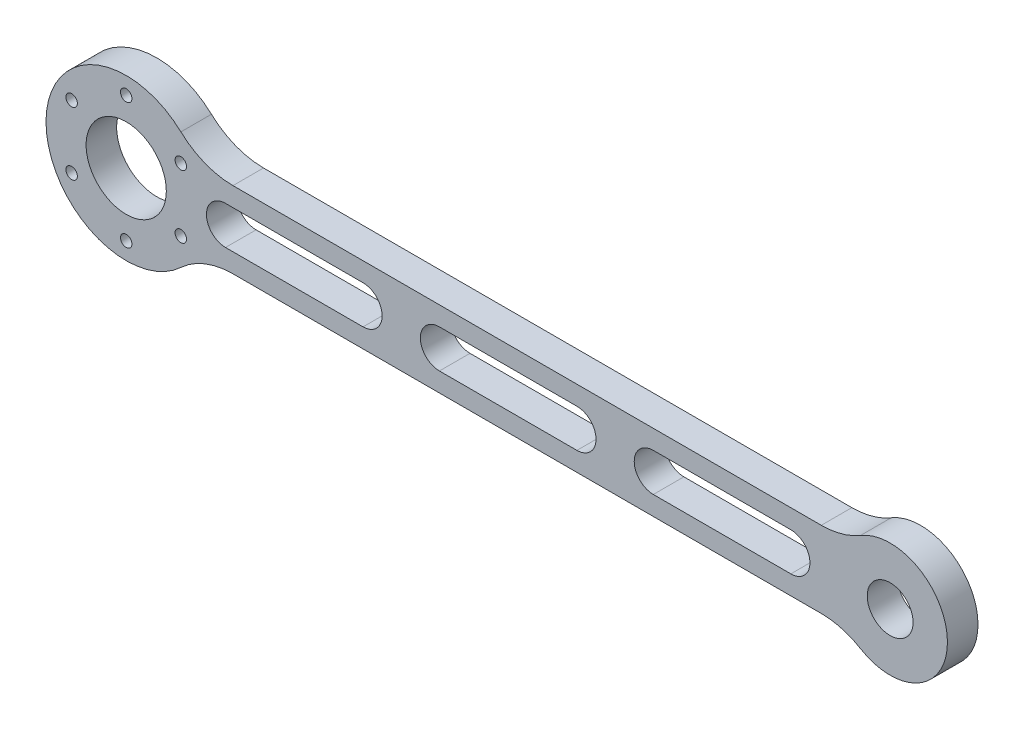
from build123d import *

# Parameters (mm, degrees)
EXTRUDE_1_DEPTH     = 8
FILLET_1_R          = 20
SKETCH_5_R          = 10.5
SKETCH_5_R_2        = 6
CUT_EXTRUDE_4_DEPTH = 10
CUT_EXTRUDE_5_DEPTH = 10
EXTRUDE_START       = -8
SKETCH_9_R          = 10.5
EXTRUDE_3_DEPTH     = 8
FILLET_2_R          = 20
SKETCH_10_R         = 1.5
CUT_EXTRUDE_7_DEPTH = 8


with BuildPart() as part:
    # 草图1 → 凸台-拉伸1 (new body)
    with BuildSketch(Plane.XY):
        with BuildLine():
            Line((0, -10), (0, 10))
            Line((0, 10), (11.180339887, 10))
            ThreePointArc((11.180339887, 10), (-15, 0), (11.180339887, -10))
            Line((11.180339887, -10), (0, -10))
        make_face()
        with BuildLine():
            Line((11.180339887, 10), (0, 10))
            Line((0, 10), (0, -10))
            Line((0, -10), (11.180339887, -10))
            ThreePointArc((11.180339887, -10), (14.012585384, -5.352331347), (15, 0))
            ThreePointArc((15, 0), (14.012585384, 5.352331347), (11.180339887, 10))
        make_face()
        with BuildLine():
            Line((188.819660113, 10), (11.180339887, 10))
            ThreePointArc((11.180339887, 10), (14.012585384, 5.352331347), (15, 0))
            ThreePointArc((15, 0), (14.012585384, -5.352331347), (11.180339887, -10))
            Line((11.180339887, -10), (188.819660113, -10))
            ThreePointArc((188.819660113, -10), (185, 0), (188.819660113, 10))
        make_face()
        with BuildLine():
            ThreePointArc((215, 0), (205.352331347, 14.012585384), (188.819660113, 10))
            Line((188.819660113, 10), (200, 10))
            Line((200, 10), (200, -10))
            Line((200, -10), (188.819660113, -10))
            ThreePointArc((188.819660113, -10), (205.352331347, -14.012585384), (215, 0))
        make_face()
        with BuildLine():
            Line((200, 10), (188.819660113, 10))
            ThreePointArc((188.819660113, 10), (185, 0), (188.819660113, -10))
            Line((188.819660113, -10), (200, -10))
            Line((200, -10), (200, 10))
        make_face()
    extrude(amount=EXTRUDE_1_DEPTH)

    # 圆角1
    fillet_1_edges = [part.edges().sort_by_distance(p)[0] for p in [
        (11.180339887, 10, 4),
        (188.819660113, 10, 4),
        (188.819660113, -10, 4),
        (11.180339887, -10, 4),
    ]]
    fillet(fillet_1_edges, radius=FILLET_1_R)

    # 草图5 → 切除-拉伸4 (cut)
    with BuildSketch(Plane.XY.offset(8)):
        Circle(SKETCH_5_R)
        with Locations((200, 0)):
            Circle(SKETCH_5_R_2)
    extrude(amount=-CUT_EXTRUDE_4_DEPTH, mode=Mode.SUBTRACT)

    # 草图6 → 切除-拉伸5 (cut)
    with BuildSketch(Plane.XY.offset(8)):
        with BuildLine():
            ThreePointArc((138, 5), (133, 0), (138, -5))
            Line((138, -5), (138, 5))
        make_face()
        with BuildLine():
            Line((138, 5), (138, -5))
            ThreePointArc((138, -5), (141.535533906, -3.535533906), (143, 0))
            ThreePointArc((143, 0), (141.535533906, 3.535533906), (138, 5))
        make_face()
        with BuildLine():
            Line((138, -5), (174, -5))
            ThreePointArc((174, -5), (169, 0), (174, 5))
            Line((174, 5), (138, 5))
            ThreePointArc((138, 5), (141.535533906, 3.535533906), (143, 0))
            ThreePointArc((143, 0), (141.535533906, -3.535533906), (138, -5))
        make_face()
        with BuildLine():
            ThreePointArc((174, 5), (169, 0), (174, -5))
            Line((174, -5), (174, 5))
        make_face()
        with BuildLine():
            Line((174, 5), (174, -5))
            ThreePointArc((174, -5), (177.535533906, -3.535533906), (179, 0))
            ThreePointArc((179, 0), (177.535533906, 3.535533906), (174, 5))
        make_face()
        with BuildLine():
            ThreePointArc((118, 5), (113, 0), (118, -5))
            Line((118, -5), (118, 5))
        make_face()
        with BuildLine():
            Line((118, 5), (118, -5))
            ThreePointArc((118, -5), (121.535533906, -3.535533906), (123, 0))
            ThreePointArc((123, 0), (121.535533906, 3.535533906), (118, 5))
        make_face()
        with BuildLine():
            Line((82, -5), (118, -5))
            ThreePointArc((118, -5), (113, 0), (118, 5))
            Line((118, 5), (82, 5))
            ThreePointArc((82, 5), (85.535533906, 3.535533906), (87, 0))
            ThreePointArc((87, 0), (85.535533906, -3.535533906), (82, -5))
        make_face()
        with BuildLine():
            ThreePointArc((82, 5), (77, 0), (82, -5))
            Line((82, -5), (82, 5))
        make_face()
        with BuildLine():
            Line((82, 5), (82, -5))
            ThreePointArc((82, -5), (85.535533906, -3.535533906), (87, 0))
            ThreePointArc((87, 0), (85.535533906, 3.535533906), (82, 5))
        make_face()
        with BuildLine():
            ThreePointArc((62, 5), (57, 0), (62, -5))
            Line((62, -5), (62, 5))
        make_face()
        with BuildLine():
            Line((62, 5), (62, -5))
            ThreePointArc((62, -5), (65.535533906, -3.535533906), (67, 0))
            ThreePointArc((67, 0), (65.535533906, 3.535533906), (62, 5))
        make_face()
        with BuildLine():
            Line((26, -5), (62, -5))
            ThreePointArc((62, -5), (57, 0), (62, 5))
            Line((62, 5), (26, 5))
            ThreePointArc((26, 5), (29.535533906, 3.535533906), (31, 0))
            ThreePointArc((31, 0), (29.535533906, -3.535533906), (26, -5))
        make_face()
        with BuildLine():
            ThreePointArc((26, 5), (21, 0), (26, -5))
            Line((26, -5), (26, 5))
        make_face()
        with BuildLine():
            Line((26, 5), (26, -5))
            ThreePointArc((26, -5), (29.535533906, -3.535533906), (31, 0))
            ThreePointArc((31, 0), (29.535533906, 3.535533906), (26, 5))
        make_face()
    extrude(amount=-CUT_EXTRUDE_5_DEPTH, mode=Mode.SUBTRACT)

    # 草图9 → 凸台-拉伸3 (add)
    with BuildSketch(Plane(origin=(0, 0, 0), x_dir=(-1, 0, 0), z_dir=(0, 0, -1)).offset(EXTRUDE_START)):
        with BuildLine():
            Line((-18.466185313, 10), (-18.466185313, -10))
            ThreePointArc((-18.466185313, -10), (21, 0), (-18.466185313, 10))
        make_face()
        with Locations(Location((0, 0, 0), (0, 0, 180))):
            Circle(SKETCH_9_R, mode=Mode.SUBTRACT)
    extrude(amount=EXTRUDE_3_DEPTH)

    # 圆角2
    fillet_2_edges = [part.edges().sort_by_distance(p)[0] for p in [
        (18.466185313, 10, 4),
        (18.466185313, -10, 4),
    ]]
    fillet(fillet_2_edges, radius=FILLET_2_R)

    # 草图10 → 切除-拉伸7 (cut)
    with BuildSketch(Plane(origin=(0, 0, 0), x_dir=(-1, 0, 0), z_dir=(0, 0, -1))):
        with Locations((0, 16.5)):
            Circle(SKETCH_10_R)
        with Locations((14.289419162, 8.25)):
            Circle(SKETCH_10_R)
        with Locations((14.289419162, -8.25)):
            Circle(SKETCH_10_R)
        with Locations((0, -16.5)):
            Circle(SKETCH_10_R)
        with Locations((-14.289419162, -8.25)):
            Circle(SKETCH_10_R)
        with Locations((-14.289419162, 8.25)):
            Circle(SKETCH_10_R)
    extrude(amount=-CUT_EXTRUDE_7_DEPTH, mode=Mode.SUBTRACT)


solid = part.part
